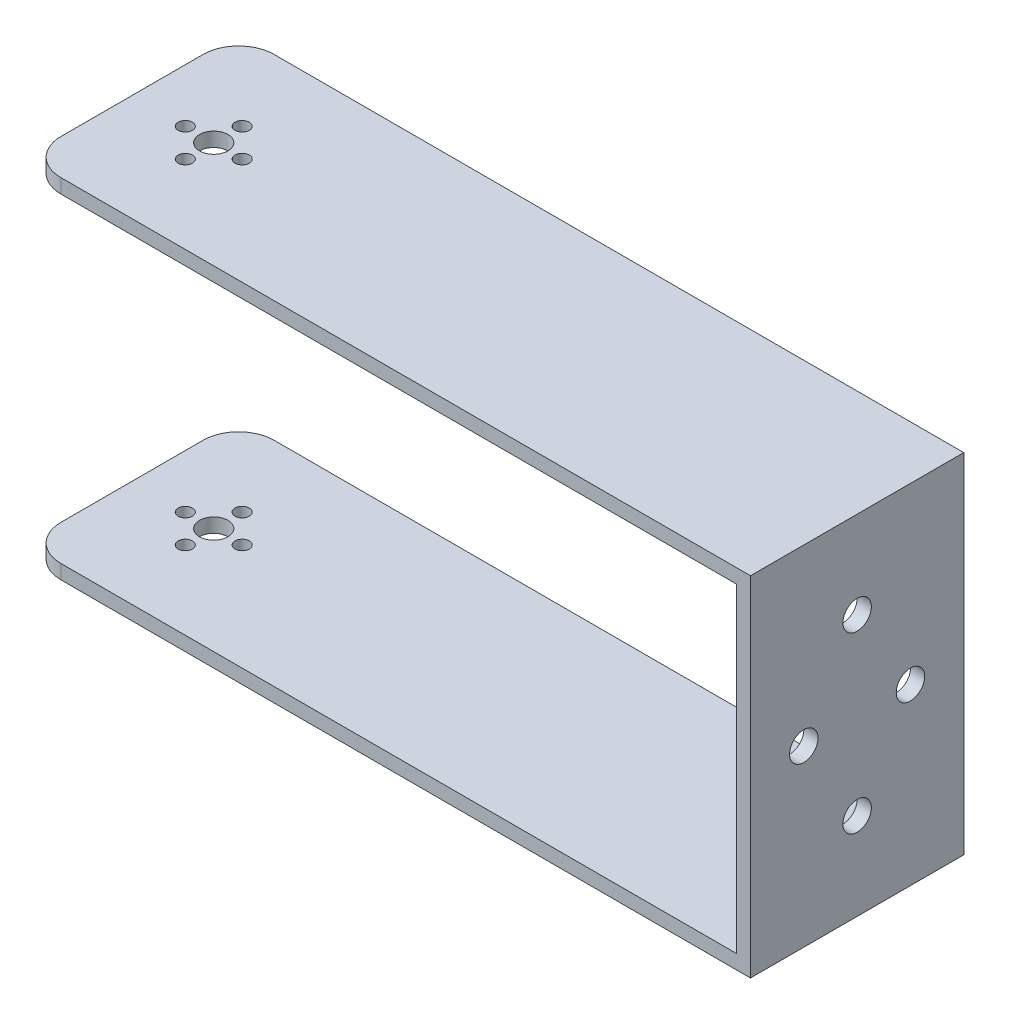
from build123d import *

# Parameters (mm, degrees)
EKSTR_ZYON_NCE1_DEPTH = 60
RADYUS1_R             = 10
KES_EKSTR_ZYON1_REACH = 236.137
IZIM2_R               = 4
IZIM2_R_2             = 2
KES_EKSTR_ZYON2_REACH = 234.491
IZIM3_R               = 4


with BuildPart() as part:
    # Çizim1 → Ekstrüzyon-İnce1 (new body)
    with BuildSketch(Plane.XY):
        Polygon((0, 0), (200, 0), (200, 90), (0, 90), (0, 94), (204, 94), (204, -4), (0, -4), align=None)
    extrude(amount=EKSTR_ZYON_NCE1_DEPTH)

    # Radyus1
    radyus1_edges = [part.edges().sort_by_distance(p)[0] for p in [
        (0, -2, 60),
        (0, 92, 60),
        (0, -2, 0),
        (0, 92, 0),
    ]]
    fillet(radyus1_edges, radius=RADYUS1_R)

    # Çizim2 → Kes-Ekstrüzyon1 (cut, up to next)
    with BuildSketch(Plane(origin=(0, 94, 0), x_dir=(1, 0, 0), z_dir=(0, 1, 0)), mode=Mode.PRIVATE) as kes_ekstr_zyon1_sk1:
        with Locations(Location((23, -30, 0), (0, 0, 270))):
            Circle(IZIM2_R)
    kes_ekstr_zyon1_tool1 = extrude(kes_ekstr_zyon1_sk1.sketch, amount=-KES_EKSTR_ZYON1_REACH, mode=Mode.PRIVATE) & part.part
    # Çizim2 → Kes-Ekstrüzyon1 (cut, up to next)
    with BuildSketch(Plane(origin=(0, 94, 0), x_dir=(1, 0, 0), z_dir=(0, 1, 0)), mode=Mode.PRIVATE) as kes_ekstr_zyon1_sk2:
        with Locations(Location((23, -22, 0), (0, 0, 270))):
            Circle(IZIM2_R_2)
    kes_ekstr_zyon1_tool2 = extrude(kes_ekstr_zyon1_sk2.sketch, amount=-KES_EKSTR_ZYON1_REACH, mode=Mode.PRIVATE) & part.part
    # Çizim2 → Kes-Ekstrüzyon1 (cut, up to next)
    with BuildSketch(Plane(origin=(0, 94, 0), x_dir=(1, 0, 0), z_dir=(0, 1, 0)), mode=Mode.PRIVATE) as kes_ekstr_zyon1_sk3:
        with Locations(Location((23, -38, 0), (0, 0, 270))):
            Circle(IZIM2_R_2)
    kes_ekstr_zyon1_tool3 = extrude(kes_ekstr_zyon1_sk3.sketch, amount=-KES_EKSTR_ZYON1_REACH, mode=Mode.PRIVATE) & part.part
    # Çizim2 → Kes-Ekstrüzyon1 (cut, up to next)
    with BuildSketch(Plane(origin=(0, 94, 0), x_dir=(1, 0, 0), z_dir=(0, 1, 0)), mode=Mode.PRIVATE) as kes_ekstr_zyon1_sk4:
        with Locations(Location((31, -30, 0), (0, 0, 270))):
            Circle(IZIM2_R_2)
    kes_ekstr_zyon1_tool4 = extrude(kes_ekstr_zyon1_sk4.sketch, amount=-KES_EKSTR_ZYON1_REACH, mode=Mode.PRIVATE) & part.part
    # Çizim2 → Kes-Ekstrüzyon1 (cut, up to next)
    with BuildSketch(Plane(origin=(0, 94, 0), x_dir=(1, 0, 0), z_dir=(0, 1, 0)), mode=Mode.PRIVATE) as kes_ekstr_zyon1_sk5:
        with Locations(Location((15, -30, 0), (0, 0, 270))):
            Circle(IZIM2_R_2)
    kes_ekstr_zyon1_tool5 = extrude(kes_ekstr_zyon1_sk5.sketch, amount=-KES_EKSTR_ZYON1_REACH, mode=Mode.PRIVATE) & part.part
    kes_ekstr_zyon1_1 = kes_ekstr_zyon1_tool1.solids().sort_by_distance((23, 94, 30))[0]
    add(kes_ekstr_zyon1_1, mode=Mode.SUBTRACT)
    kes_ekstr_zyon1_2 = kes_ekstr_zyon1_tool2.solids().sort_by_distance((23, 94, 22))[0]
    add(kes_ekstr_zyon1_2, mode=Mode.SUBTRACT)
    kes_ekstr_zyon1_3 = kes_ekstr_zyon1_tool3.solids().sort_by_distance((23, 94, 38))[0]
    add(kes_ekstr_zyon1_3, mode=Mode.SUBTRACT)
    kes_ekstr_zyon1_4 = kes_ekstr_zyon1_tool4.solids().sort_by_distance((31, 94, 30))[0]
    add(kes_ekstr_zyon1_4, mode=Mode.SUBTRACT)
    kes_ekstr_zyon1_5 = kes_ekstr_zyon1_tool5.solids().sort_by_distance((15, 94, 30))[0]
    add(kes_ekstr_zyon1_5, mode=Mode.SUBTRACT)
    kes_ekstr_zyon1 = kes_ekstr_zyon1_1 + kes_ekstr_zyon1_2 + kes_ekstr_zyon1_3 + kes_ekstr_zyon1_4 + kes_ekstr_zyon1_5  # Kes-Ekstrüzyon1 as one shape, for the pattern or mirror that repeats it

    # Aynalama1: Kes-Ekstrüzyon1 across plane
    add(kes_ekstr_zyon1.mirror(Plane.ZX.offset(45)), mode=Mode.SUBTRACT)

    # Çizim3 → Kes-Ekstrüzyon2 (cut, up to next)
    with BuildSketch(Plane(origin=(204, 0, 0), x_dir=(0, 0, -1), z_dir=(1, 0, 0)), mode=Mode.PRIVATE) as kes_ekstr_zyon2_sk1:
        with Locations((-30, 69.5)):
            Circle(IZIM3_R)
    kes_ekstr_zyon2_tool1 = extrude(kes_ekstr_zyon2_sk1.sketch, amount=-KES_EKSTR_ZYON2_REACH, mode=Mode.PRIVATE) & part.part
    # Çizim3 → Kes-Ekstrüzyon2 (cut, up to next)
    with BuildSketch(Plane(origin=(204, 0, 0), x_dir=(0, 0, -1), z_dir=(1, 0, 0)), mode=Mode.PRIVATE) as kes_ekstr_zyon2_sk2:
        with Locations((-45, 45)):
            Circle(IZIM3_R)
    kes_ekstr_zyon2_tool2 = extrude(kes_ekstr_zyon2_sk2.sketch, amount=-KES_EKSTR_ZYON2_REACH, mode=Mode.PRIVATE) & part.part
    # Çizim3 → Kes-Ekstrüzyon2 (cut, up to next)
    with BuildSketch(Plane(origin=(204, 0, 0), x_dir=(0, 0, -1), z_dir=(1, 0, 0)), mode=Mode.PRIVATE) as kes_ekstr_zyon2_sk3:
        with Locations(Location((-15, 45, 0), (0, 0, 180))):
            Circle(IZIM3_R)
    kes_ekstr_zyon2_tool3 = extrude(kes_ekstr_zyon2_sk3.sketch, amount=-KES_EKSTR_ZYON2_REACH, mode=Mode.PRIVATE) & part.part
    # Çizim3 → Kes-Ekstrüzyon2 (cut, up to next)
    with BuildSketch(Plane(origin=(204, 0, 0), x_dir=(0, 0, -1), z_dir=(1, 0, 0)), mode=Mode.PRIVATE) as kes_ekstr_zyon2_sk4:
        with Locations(Location((-30, 20.5, 0), (0, 0, 180))):
            Circle(IZIM3_R)
    kes_ekstr_zyon2_tool4 = extrude(kes_ekstr_zyon2_sk4.sketch, amount=-KES_EKSTR_ZYON2_REACH, mode=Mode.PRIVATE) & part.part
    add(kes_ekstr_zyon2_tool1.solids().sort_by_distance((204, 69.5, 30))[0], mode=Mode.SUBTRACT)
    add(kes_ekstr_zyon2_tool2.solids().sort_by_distance((204, 45, 45))[0], mode=Mode.SUBTRACT)
    add(kes_ekstr_zyon2_tool3.solids().sort_by_distance((204, 45, 15))[0], mode=Mode.SUBTRACT)
    add(kes_ekstr_zyon2_tool4.solids().sort_by_distance((204, 20.5, 30))[0], mode=Mode.SUBTRACT)


solid = part.part
